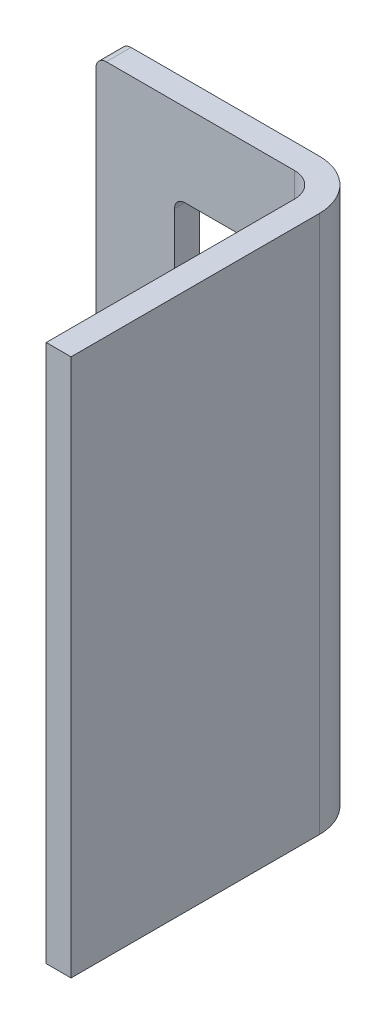
from build123d import *

# Parameters (mm, degrees)
EXTRUDE_26_DEPTH       = 26
SKETCH_18_5_Y138_5_W   = 5
SKETCH_18_5_Y138_5_H   = 18
CUT_EXTRUDE_18_5_DEPTH = 1.2
FILLET_R0_5_R          = 0.5
FILLET_R0_5_2_R        = 0.5


with BuildPart() as part:
    # 草图_L形卡耳_内伸12_厚1点2_内R1点2_焊脚12 → 拉伸_卡耳外高26 (new body)
    with BuildSketch(Plane(origin=(0, 125.5, 0), x_dir=(1, 0, 0), z_dir=(0, 1, 0))):
        with BuildLine():
            Line((59.2, 303.8), (68.8, 303.8))
            ThreePointArc((68.8, 303.8), (70.497056275, 303.097056275), (71.2, 301.4))
            Line((71.2, 301.4), (71.2, 289.4))
            Line((71.2, 289.4), (70, 289.4))
            Line((70, 289.4), (70, 301.4))
            ThreePointArc((70, 301.4), (69.648528137, 302.248528137), (68.8, 302.6))
            Line((68.8, 302.6), (59.2, 302.6))
            Line((59.2, 302.6), (59.2, 303.8))
        make_face()
    extrude(amount=EXTRUDE_26_DEPTH)

    # 草图_卡槽矩形_净高18_净宽5_中心Y138点5 → 切除_卡槽18乘5 (cut)
    with BuildSketch(Plane.XY.offset(-302.6)):
        with Locations((65.5, 138.5)):
            Rectangle(SKETCH_18_5_Y138_5_W, SKETCH_18_5_Y138_5_H)
    extrude(amount=-CUT_EXTRUDE_18_5_DEPTH, mode=Mode.SUBTRACT)

    # Fillet R0_5
    fillet_r0_5_edges = [part.edges().sort_by_distance(p)[0] for p in [
        (68, 147.5, -303.2),
        (68, 129.5, -303.2),
        (63, 129.5, -303.2),
        (63, 147.5, -303.2),
    ]]
    fillet(fillet_r0_5_edges, radius=FILLET_R0_5_R)

    # Fillet R0_5 2
    fillet_r0_5_2_edges = [part.edges().sort_by_distance(p)[0] for p in [
        (59.2, 125.5, -303.2),
        (59.2, 151.5, -303.2),
    ]]
    fillet(fillet_r0_5_2_edges, radius=FILLET_R0_5_2_R)


solid = part.part
